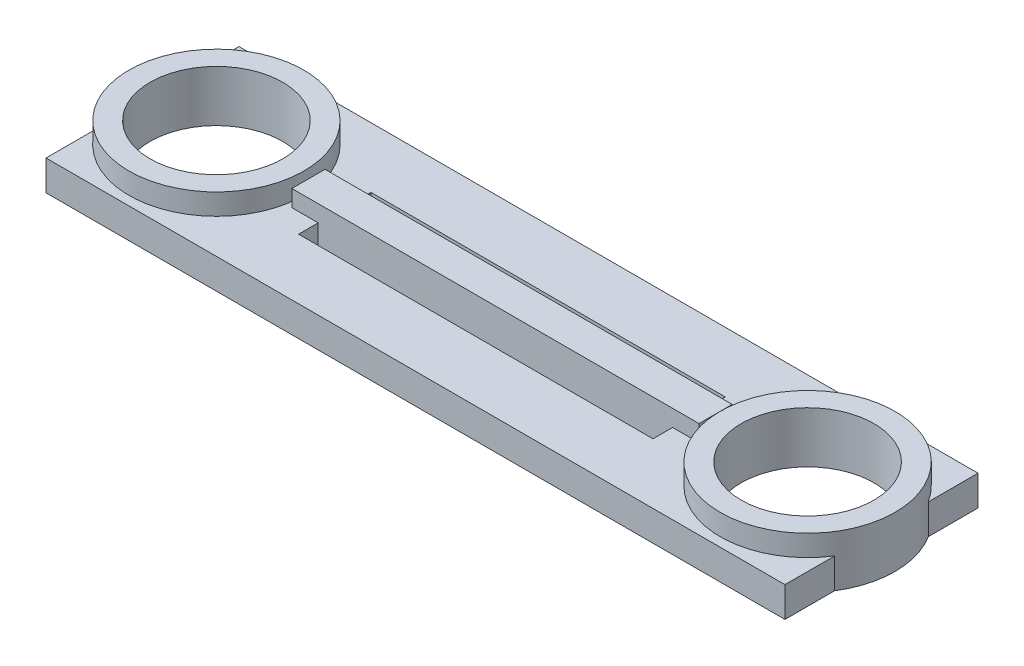
from build123d import *

# Parameters (mm, degrees)
F_01_LINK_PROFILE_W            = 490
F_01_LINK_PROFILE_H            = 128
F_01_LINK_PROFILE_R            = 44
F_01_LINK_PROFILE_W_2          = 235
F_01_LINK_PROFILE_H_2          = 48
F_01_LINK_PLATE_DEPTH          = 20
F_02_END_BOSS_PROFILES_R       = 58
F_02_END_BOSS_PROFILES_R_2     = 44
F_02_BEARING_SEAT_BOSSES_DEPTH = 34
F_03_CENTER_RIB_PROFILE_W      = 270
F_03_CENTER_RIB_PROFILE_H      = 22
F_03_CENTER_RIB_DEPTH          = 31


with BuildPart() as part:
    # 01_Link_Profile → 01_Link_Plate (new body)
    with BuildSketch(Plane(origin=(0, 0, 0), x_dir=(1, 0, 0), z_dir=(0, 1, 0))):
        Rectangle(F_01_LINK_PROFILE_W, F_01_LINK_PROFILE_H)
        with Locations(Location((-196, 0, 0), (0, 0, 270))):
            Circle(F_01_LINK_PROFILE_R, mode=Mode.SUBTRACT)
        with Locations(Location((196, 0, 0), (0, 0, 270))):
            Circle(F_01_LINK_PROFILE_R, mode=Mode.SUBTRACT)
        Rectangle(F_01_LINK_PROFILE_W_2, F_01_LINK_PROFILE_H_2, mode=Mode.SUBTRACT)
    extrude(amount=F_01_LINK_PLATE_DEPTH)

    # 02_End_Boss_Profiles → 02_Bearing_Seat_Bosses (add)
    # profile 1 of 2: a face of its own
    with BuildSketch(Plane(origin=(0, 0, 0), x_dir=(1, 0, 0), z_dir=(0, 1, 0))):
        with Locations(Location((-196, 0, 0), (0, 0, 147.653467871))):
            Circle(F_02_END_BOSS_PROFILES_R)
        with Locations(Location((-196, 0, 0), (0, 0, 270))):
            Circle(F_02_END_BOSS_PROFILES_R_2, mode=Mode.SUBTRACT)
    # profile 2 of 2: a face of its own
    with BuildSketch(Plane(origin=(0, 0, 0), x_dir=(1, 0, 0), z_dir=(0, 1, 0))):
        with Locations(Location((196, 0, 0), (0, 0, 32.346532129))):
            Circle(F_02_END_BOSS_PROFILES_R)
        with Locations(Location((196, 0, 0), (0, 0, 270))):
            Circle(F_02_END_BOSS_PROFILES_R_2, mode=Mode.SUBTRACT)
    extrude(amount=F_02_BEARING_SEAT_BOSSES_DEPTH)

    # 03_Center_Rib_Profile → 03_Center_Rib (add)
    with BuildSketch(Plane(origin=(0, 0, 0), x_dir=(1, 0, 0), z_dir=(0, 1, 0))):
        Rectangle(F_03_CENTER_RIB_PROFILE_W, F_03_CENTER_RIB_PROFILE_H)
    extrude(amount=F_03_CENTER_RIB_DEPTH)


solid = part.part
